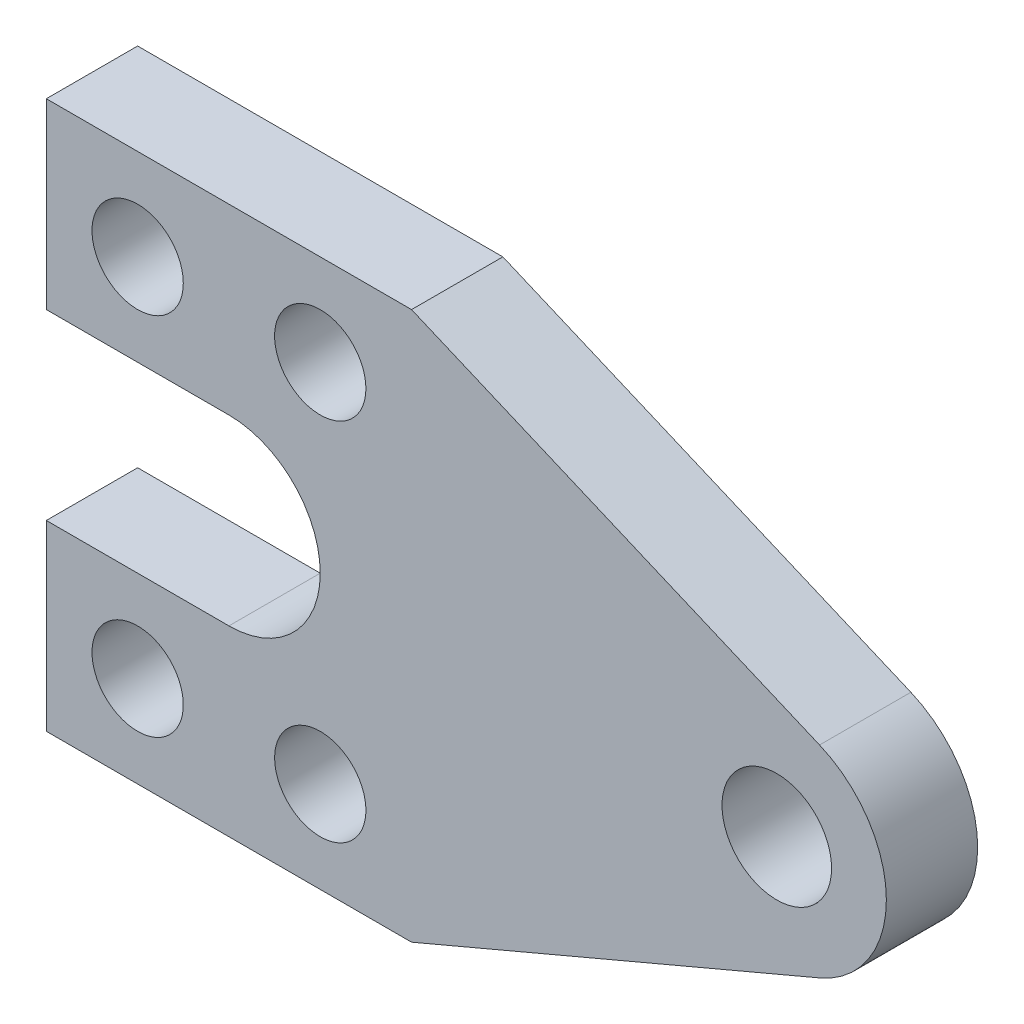
from build123d import *

# Parameters (mm, degrees)
SKETCH1_R           = 6
SKETCH1_R_2         = 5
BOSS_EXTRUDE1_DEPTH = 10


with BuildPart() as part:
    # Sketch1 → Boss-Extrude1 (new body)
    with BuildSketch(Plane.XY):
        with BuildLine():
            Line((10, 70), (50, 70))
            Line((50, 70), (94.685564793, 51.047419724))
            ThreePointArc((94.685564793, 51.047419724), (102, 40), (94.685564793, 28.952580276))
            Line((94.685564793, 28.952580276), (50, 10))
            Line((50, 10), (10, 10))
            Line((10, 10), (10, 30))
            Line((10, 30), (30, 30))
            ThreePointArc((30, 30), (40, 40), (30, 50))
            Line((30, 50), (10, 50))
            Line((10, 50), (10, 70))
        make_face()
        with Locations((90, 40)):
            Circle(SKETCH1_R, mode=Mode.SUBTRACT)
        with Locations((20, 60)):
            Circle(SKETCH1_R_2, mode=Mode.SUBTRACT)
        with Locations((40, 60)):
            Circle(SKETCH1_R_2, mode=Mode.SUBTRACT)
        with Locations(Location((40, 20, 0), (0, 0, 180))):
            Circle(SKETCH1_R_2, mode=Mode.SUBTRACT)
        with Locations(Location((20, 20, 0), (0, 0, 180))):
            Circle(SKETCH1_R_2, mode=Mode.SUBTRACT)
    extrude(amount=BOSS_EXTRUDE1_DEPTH)


solid = part.part
